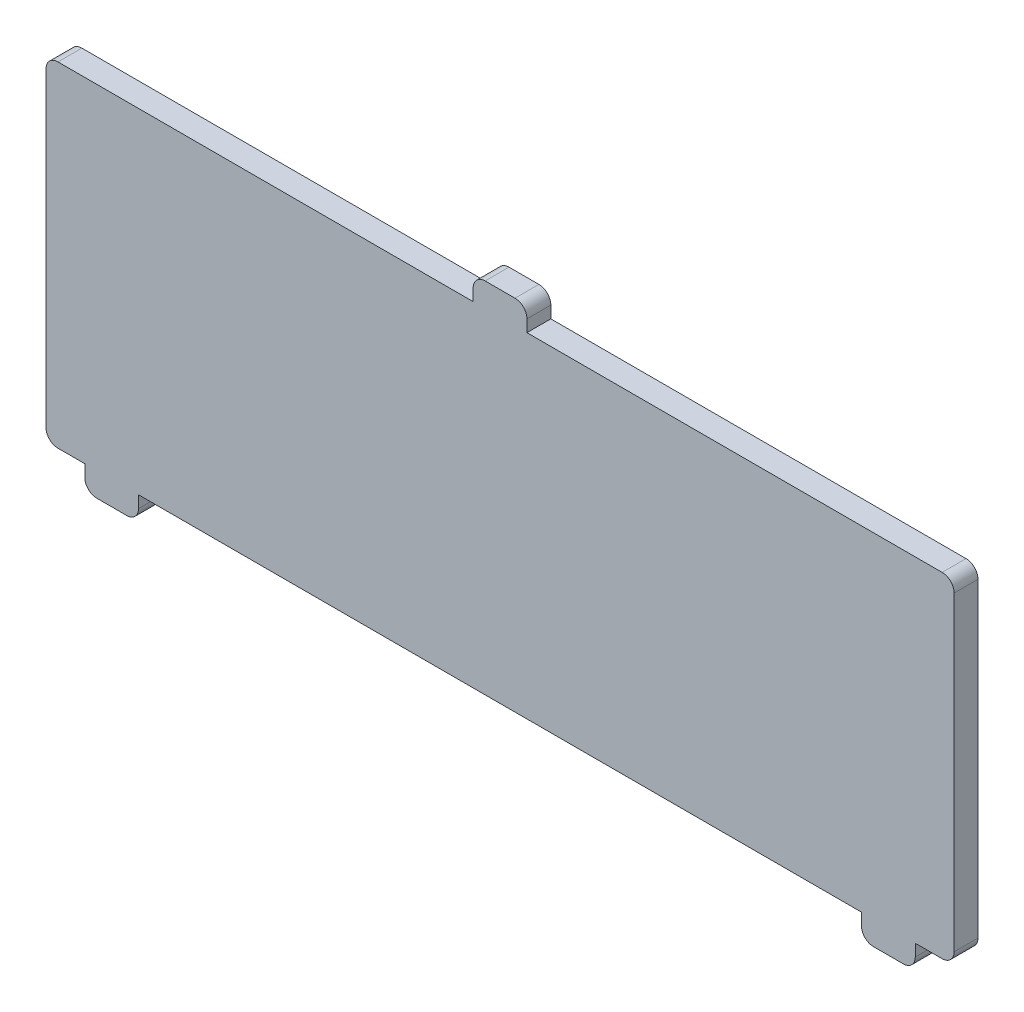
from build123d import *

# Parameters (mm, degrees)
SKETCH1_W           = 76
SKETCH1_H           = 28
SKETCH1_W_2         = 4.5
SKETCH1_H_2         = 2
BOSS_EXTRUDE1_DEPTH = 1
FILLET1_R           = 1


with BuildPart() as part:
    # Sketch1 → Boss-Extrude1 (new, symmetric)
    with BuildSketch(Plane.XY):
        Rectangle(SKETCH1_W, SKETCH1_H)
        with Locations((-32.5, -15)):
            Rectangle(SKETCH1_W_2, SKETCH1_H_2)
        with Locations((32.5, -15)):
            Rectangle(SKETCH1_W_2, SKETCH1_H_2)
        with Locations((0, 15)):
            Rectangle(SKETCH1_W_2, SKETCH1_H_2)
    extrude(amount=BOSS_EXTRUDE1_DEPTH, both=True)

    # Fillet1
    fillet1_edges = [part.edges().sort_by_distance(p)[0] for p in [
        (38, -14, 0),
        (34.75, -16, 0),
        (30.25, -16, 0),
        (-30.25, -16, 0),
        (-34.75, -16, 0),
        (-38, -14, 0),
        (-38, 14, 0),
        (38, 14, 0),
        (2.25, 16, 0),
        (-2.25, 16, 0),
    ]]
    fillet(fillet1_edges, radius=FILLET1_R)


solid = part.part
